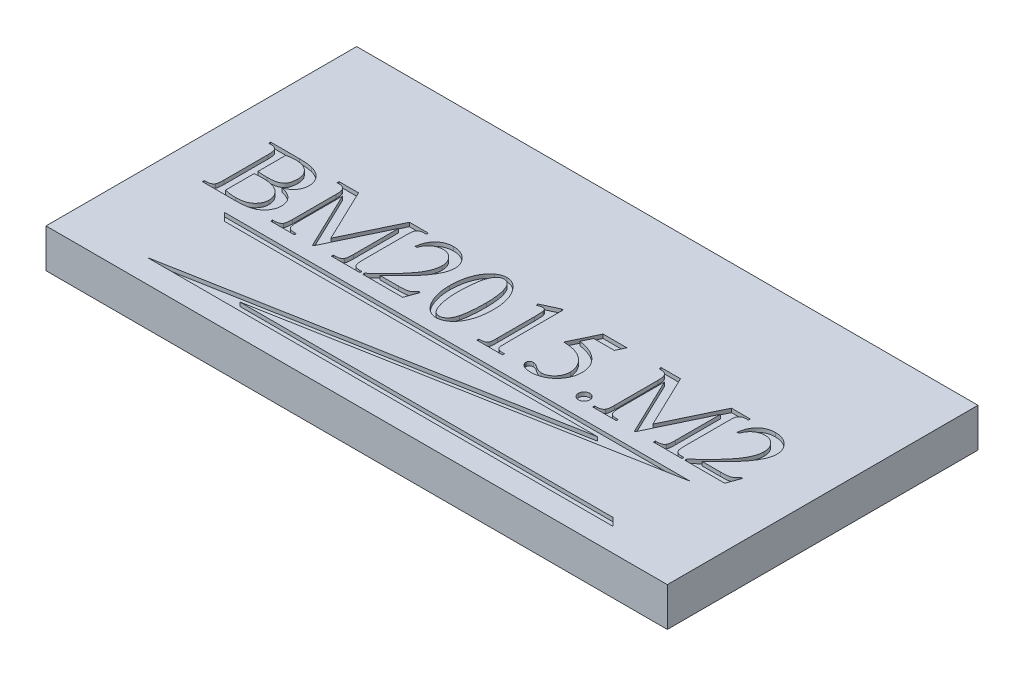
from build123d import *

# Parameters (mm, degrees)
SKETCH_1_W          = 160
SKETCH_1_H          = 80
EXTRUDE_1_DEPTH     = 10
CUT_EXTRUDE_1_DEPTH = 1
CUT_EXTRUDE_2_DEPTH = 1


with BuildPart() as part:
    # Эскиз1 → Бобышка-Вытянуть1 (new body)
    with BuildSketch(Plane(origin=(0, 0, 0), x_dir=(1, 0, 0), z_dir=(0, 1, 0))):
        Rectangle(SKETCH_1_W, SKETCH_1_H)
    extrude(amount=EXTRUDE_1_DEPTH)

    # Эскиз2 → Вырез-Вытянуть1 (cut)
    # profile 1 of 9: a face of its own
    with BuildSketch(Plane(origin=(0, 10, 0), x_dir=(1, 0, 0), z_dir=(0, 1, 0))):
        with BuildLine():
            add(Edge.make_bspline(
                [(-58.083307054, -1.12936359), (-57.935151583, -1.162218616), (-57.647224583, -1.226069441), (-57.233701046, -1.344617735), (-56.85051146, -1.47956541), (-56.493404032, -1.623649358), (-56.164474978, -1.783325876), (-55.864999545, -1.959081857), (-55.595654967, -2.150476291), (-55.433679051, -2.291199058), (-55.354468452, -2.360016293)],
                knots=[0, 0, 0, 0, 1.202298385, 2.336560135, 3.406084711, 4.420247637, 5.386399354, 6.300522109, 7.168909389, 8, 8, 8, 8], degree=3))
            add(Edge.make_bspline(
                [(-55.354468452, -2.360016293), (-55.254240258, -2.45868109), (-55.056391441, -2.653443788), (-54.800647537, -2.975704736), (-54.585222065, -3.31438968), (-54.407168596, -3.668692158), (-54.270098938, -4.040713305), (-54.169543605, -4.428340837), (-54.111729232, -4.832307411), (-54.104533282, -5.106509479), (-54.100884332, -5.245552911)],
                knots=[0, 0, 0, 0, 1.040892545, 2.054704896, 3.038886078, 4.009403739, 4.985637774, 5.96968326, 6.970459233, 8, 8, 8, 8], degree=3))
            add(Edge.make_bspline(
                [(-54.100884332, -5.245552911), (-54.109773906, -5.459326742), (-54.127634896, -5.888842475), (-54.295807273, -6.522135238), (-54.552689425, -7.143512483), (-54.912842113, -7.737821359), (-55.35300588, -8.29336594), (-55.890156435, -8.76594946), (-56.496512251, -9.163913784), (-57.062965395, -9.427120756), (-57.567328024, -9.591580546), (-57.996528063, -9.700807422), (-58.471665181, -9.79862292), (-58.995936524, -9.865487586), (-59.565085802, -9.929753148), (-60.182391491, -9.968570826), (-60.846269083, -9.997197456), (-61.305134604, -9.999045516), (-61.542129093, -10)],
                knots=[0, 0, 0, 0, 1.028770293, 2.067011775, 3.138033473, 4.261901228, 5.406207792, 6.541562624, 7.694800496, 8.892876887, 9.539626609, 10.250184141, 11.027081459, 11.876550478, 12.796927842, 13.788050093, 14.85757392, 16, 16, 16, 16], degree=3))
            Line((-61.542129093, -10), (-69.75539822, -10))
            Line((-69.75539822, -10), (-69.75539822, -9.510796441))
            Line((-69.75539822, -9.510796441), (-69.117140452, -9.510796441))
            add(Edge.make_bspline(
                [(-69.117140452, -9.510796441), (-69.031623978, -9.508896469), (-68.866223486, -9.505221663), (-68.628601462, -9.468555371), (-68.407591735, -9.418383705), (-68.208553017, -9.33583787), (-68.025639816, -9.235762485), (-67.860349201, -9.114310171), (-67.716452197, -8.965560139), (-67.636649307, -8.85326698), (-67.596023136, -8.796100616)],
                knots=[0, 0, 0, 0, 1.166786496, 2.256723755, 3.277842578, 4.25348796, 5.187934752, 6.120436128, 7.043148905, 8, 8, 8, 8], degree=3))
            add(Edge.make_bspline(
                [(-67.596023136, -8.796100616), (-67.571713165, -8.752126879), (-67.519273623, -8.65727022), (-67.465120099, -8.488517952), (-67.415028953, -8.29096451), (-67.378860094, -8.059207847), (-67.348406901, -7.795301677), (-67.326671955, -7.498195236), (-67.310194933, -7.169426686), (-67.309659765, -6.939953985), (-67.309380425, -6.820176866)],
                knots=[0, 0, 0, 0, 0.597321695, 1.288494999, 2.101981578, 3.025155317, 4.079375286, 5.266669335, 6.573292293, 8, 8, 8, 8], degree=3))
            Line((-67.309380425, -6.820176866), (-67.309380425, 4.431504991))
            add(Edge.make_bspline(
                [(-67.309380425, 4.431504991), (-67.309187714, 4.564044157), (-67.308820582, 4.816542143), (-67.331060069, 5.175734867), (-67.353432169, 5.49775157), (-67.397357301, 5.780488463), (-67.445093055, 6.026200292), (-67.503113973, 6.234101896), (-67.579857841, 6.40226176), (-67.643258386, 6.494765474), (-67.672461192, 6.537373437)],
                knots=[0, 0, 0, 0, 1.467983741, 2.79662948, 3.986363477, 5.042318655, 5.964098798, 6.759038926, 7.428403245, 8, 8, 8, 8], degree=3))
            add(Edge.make_bspline(
                [(-67.672461192, 6.537373437), (-67.75871544, 6.62793383), (-67.93276243, 6.810669917), (-68.27906898, 6.993817977), (-68.679994602, 7.101831697), (-68.966045307, 7.115110536), (-69.117140452, 7.122124566)],
                knots=[0, 0, 0, 0, 0.927123666, 1.870784184, 2.875324672, 4, 4, 4, 4], degree=3))
            Line((-69.117140452, 7.122124566), (-69.75539822, 7.122124566))
            Line((-69.75539822, 7.122124566), (-69.75539822, 7.611328125))
            Line((-69.75539822, 7.611328125), (-62.321797265, 7.611328125))
            add(Edge.make_bspline(
                [(-62.321797265, 7.611328125), (-61.991696852, 7.608620798), (-61.366532154, 7.603493494), (-60.480230914, 7.540198231), (-59.694905134, 7.449140638), (-59.211425828, 7.343516417), (-58.985276116, 7.294110192)],
                knots=[0, 0, 0, 0, 1.179035714, 2.232931189, 3.173445281, 4, 4, 4, 4], degree=3))
            add(Edge.make_bspline(
                [(-58.985276116, 7.294110192), (-58.830475378, 7.252962713), (-58.528036356, 7.172571601), (-58.094236564, 7.017852333), (-57.687918639, 6.842263366), (-57.308550965, 6.64475572), (-56.960169398, 6.420895489), (-56.635313397, 6.180274305), (-56.341120668, 5.912497706), (-56.077791535, 5.621954778), (-55.845558733, 5.314460125), (-55.635433656, 4.998206342), (-55.46620313, 4.664377227), (-55.321125295, 4.323333768), (-55.216617894, 3.968594551), (-55.133743431, 3.605365528), (-55.088177792, 3.228770232), (-55.082276671, 2.974197134), (-55.07929145, 2.845415327)],
                knots=[0, 0, 0, 0, 1.197163213, 2.33893505, 3.43955965, 4.504702612, 5.532566955, 6.532694419, 7.523891994, 8.501634608, 9.459882266, 10.403051993, 11.336018195, 12.25408421, 13.170072591, 14.09679423, 15.037218469, 16, 16, 16, 16], degree=3))
            add(Edge.make_bspline(
                [(-55.07929145, 2.845415327), (-55.087105251, 2.626697856), (-55.102503874, 2.195672354), (-55.254775946, 1.570239949), (-55.494999798, 0.980157447), (-55.769984581, 0.520936195), (-56.040008985, 0.18304697), (-56.260992368, -0.061223322), (-56.510751786, -0.280656081), (-56.780704725, -0.486435746), (-57.075219861, -0.671124202), (-57.389016851, -0.845114708), (-57.727138198, -0.997833345), (-57.962993001, -1.084932594), (-58.083307054, -1.12936359)],
                knots=[0, 0, 0, 0, 1.471082931, 2.899056279, 4.307818116, 5.751614296, 6.484736272, 7.219614112, 7.967209451, 8.720692231, 9.503935749, 10.306636219, 11.136182697, 12, 12, 12, 12], degree=3))
        make_face()
        with BuildLine():
            add(Edge.make_bspline(
                [(-64.86336263, -0.514037238), (-64.692945887, -0.544093737), (-64.330720479, -0.607979641), (-63.74976447, -0.665695354), (-63.104427144, -0.699142348), (-62.653075855, -0.703077259), (-62.417344835, -0.705132378)],
                knots=[0, 0, 0, 0, 0.844887106, 1.795830451, 2.848809897, 4, 4, 4, 4], degree=3))
            add(Edge.make_bspline(
                [(-62.417344835, -0.705132378), (-62.264458487, -0.703354118), (-61.968755926, -0.699914726), (-61.540241642, -0.682406439), (-61.141479761, -0.646432822), (-60.77225986, -0.603915856), (-60.432400817, -0.539958425), (-60.120906283, -0.471510955), (-59.83948761, -0.381490273), (-59.509469981, -0.253532815), (-59.145320321, -0.055754639), (-58.782767834, 0.249409046), (-58.5028781, 0.615111097), (-58.309990283, 1.035402248), (-58.185415618, 1.49099766), (-58.082207176, 1.965085911), (-58.025496826, 2.460574051), (-58.018212998, 2.796874932), (-58.014512804, 2.967716217)],
                knots=[0, 0, 0, 0, 1.091830023, 2.111744693, 3.061402081, 3.95056914, 4.764258185, 5.530001833, 6.226288629, 6.871621508, 8.056545267, 9.166642, 10.231067328, 11.317616446, 12.446050905, 13.598649409, 14.780110772, 16, 16, 16, 16], degree=3))
            add(Edge.make_bspline(
                [(-58.014512804, 2.967716217), (-58.018532349, 3.100348912), (-58.026450031, 3.361608221), (-58.078788197, 3.746816082), (-58.17745199, 4.11571906), (-58.305925913, 4.471005959), (-58.472293973, 4.812706909), (-58.678876152, 5.1359246), (-58.923389495, 5.44449433), (-59.199645402, 5.737669378), (-59.513245855, 6.006493611), (-59.863872586, 6.240298016), (-60.246837904, 6.439488964), (-60.665050033, 6.600434926), (-61.115481955, 6.726083784), (-61.601863798, 6.812476281), (-62.120568156, 6.866431758), (-62.478357766, 6.873761667), (-62.661946615, 6.877522786)],
                knots=[0, 0, 0, 0, 0.932104058, 1.836054539, 2.724128921, 3.610577454, 4.48739039, 5.388899496, 6.300486582, 7.250348221, 8.215526472, 9.196272454, 10.205292906, 11.242666987, 12.339557976, 13.48617357, 14.710106481, 16, 16, 16, 16], degree=3))
            add(Edge.make_bspline(
                [(-62.661946615, 6.877522786), (-62.860795409, 6.873608591), (-63.249040527, 6.865966266), (-63.816627037, 6.813568002), (-64.353439342, 6.719038008), (-64.695808207, 6.625292952), (-64.86336263, 6.579414368)],
                knots=[0, 0, 0, 0, 1.070391011, 2.089899941, 3.065202048, 4, 4, 4, 4], degree=3))
            Line((-64.86336263, 6.579414368), (-64.86336263, -0.514037238))
        make_face(mode=Mode.SUBTRACT)
        with BuildLine():
            add(Edge.make_bspline(
                [(-64.86336263, -8.910757701), (-64.61299155, -8.966180517), (-64.114860083, -9.076448239), (-63.363817105, -9.184042878), (-62.617351025, -9.252129061), (-62.121930429, -9.261511361), (-61.874634637, -9.266194661)],
                knots=[0, 0, 0, 0, 1.019899824, 2.029164851, 3.016231376, 4, 4, 4, 4], degree=3))
            add(Edge.make_bspline(
                [(-61.874634637, -9.266194661), (-61.683369781, -9.264270033), (-61.312764466, -9.260540768), (-60.774376461, -9.2029356), (-60.270130022, -9.1230579), (-59.801690352, -9.002553889), (-59.365782736, -8.856219159), (-58.968358656, -8.667884751), (-58.604287484, -8.448091229), (-58.275754279, -8.197059756), (-57.988329946, -7.917211908), (-57.731150394, -7.625922238), (-57.51743584, -7.314627966), (-57.338767101, -6.989153368), (-57.205635762, -6.643858337), (-57.105081161, -6.286025716), (-57.046688177, -5.909925052), (-57.039679488, -5.654695807), (-57.036105686, -5.524551815)],
                knots=[0, 0, 0, 0, 1.335369974, 2.58748639, 3.778398001, 4.898614871, 5.962444548, 6.985554789, 7.963871145, 8.928614683, 9.866425566, 10.762210136, 11.638554271, 12.498661649, 13.349744001, 14.217688406, 15.091181162, 16, 16, 16, 16], degree=3))
            add(Edge.make_bspline(
                [(-57.036105686, -5.524551815), (-57.044261503, -5.352107441), (-57.060606005, -5.006523727), (-57.16883186, -4.492320686), (-57.362031352, -3.993866839), (-57.61631526, -3.505399873), (-57.950977807, -3.043834451), (-58.380301928, -2.636913587), (-58.88735204, -2.276838993), (-59.479994141, -1.978732112), (-60.147210303, -1.733123454), (-60.891331413, -1.559195298), (-61.708700466, -1.456962118), (-62.278174481, -1.445100422), (-62.57404285, -1.438937717)],
                knots=[0, 0, 0, 0, 0.80426076, 1.611762754, 2.437163379, 3.29025987, 4.174362993, 5.081949637, 6.03643416, 7.064744133, 8.166225842, 9.344998398, 10.620602567, 12, 12, 12, 12], degree=3))
            add(Edge.make_bspline(
                [(-62.57404285, -1.438937717), (-62.702722848, -1.438160339), (-62.951191532, -1.436659297), (-63.309109527, -1.447026636), (-63.637907963, -1.452656868), (-64.017637519, -1.468393209), (-64.424649074, -1.488178676), (-64.72856052, -1.536142157), (-64.86336263, -1.557416704)],
                knots=[0, 0, 0, 0, 1.009225997, 1.948718216, 2.808291512, 3.588270035, 4.930259813, 6, 6, 6, 6], degree=3))
            Line((-64.86336263, -1.557416704), (-64.86336263, -8.910757701))
        make_face(mode=Mode.SUBTRACT)
    # profile 2 of 9: a face of its own
    with BuildSketch(Plane(origin=(0, 10, 0), x_dir=(1, 0, 0), z_dir=(0, 1, 0))):
        with BuildLine():
            Line((-41.381591797, -10), (-48.475043403, 4.817517175))
            Line((-48.475043403, 4.817517175), (-48.475043403, -6.820176866))
            add(Edge.make_bspline(
                [(-48.475043403, -6.820176866), (-48.475224162, -6.955261145), (-48.475567139, -7.211573693), (-48.453681123, -7.57589808), (-48.429942711, -7.901426525), (-48.390519157, -8.186701203), (-48.348683291, -8.434798906), (-48.286350012, -8.639672396), (-48.221565226, -8.809918629), (-48.159424357, -8.900159771), (-48.13107215, -8.941332923)],
                knots=[0, 0, 0, 0, 1.48973486, 2.826663046, 4.025252461, 5.088590954, 6.003687083, 6.795186099, 7.45029523, 8, 8, 8, 8], degree=3))
            add(Edge.make_bspline(
                [(-48.13107215, -8.941332923), (-48.044633234, -9.029283516), (-47.868608314, -9.208386828), (-47.515174715, -9.388466568), (-47.099129811, -9.495079221), (-46.799236034, -9.505357239), (-46.640530056, -9.510796441)],
                knots=[0, 0, 0, 0, 0.893460505, 1.819450328, 2.846037184, 4, 4, 4, 4], degree=3))
            Line((-46.640530056, -9.510796441), (-46.029025608, -9.510796441))
            Line((-46.029025608, -9.510796441), (-46.029025608, -10))
            Line((-46.029025608, -10), (-52.144070095, -10))
            Line((-52.144070095, -10), (-52.144070095, -9.510796441))
            Line((-52.144070095, -9.510796441), (-51.532565647, -9.510796441))
            add(Edge.make_bspline(
                [(-51.532565647, -9.510796441), (-51.444512528, -9.508874283), (-51.274061196, -9.505153411), (-51.028740976, -9.468702177), (-50.802097877, -9.418104563), (-50.595868322, -9.33937337), (-50.40809511, -9.241570039), (-50.241366342, -9.118046394), (-50.09860767, -8.969822735), (-50.017862565, -8.859503545), (-49.977051205, -8.803744422)],
                knots=[0, 0, 0, 0, 1.182386838, 2.288838982, 3.326958154, 4.296765023, 5.246416275, 6.164047556, 7.072046332, 8, 8, 8, 8], degree=3))
            add(Edge.make_bspline(
                [(-49.977051205, -8.803744422), (-49.954270382, -8.762227325), (-49.904120352, -8.670830994), (-49.848621244, -8.508339338), (-49.805341866, -8.310440578), (-49.762452009, -8.080093594), (-49.732410828, -7.813218108), (-49.716775585, -7.513311385), (-49.698335248, -7.178367859), (-49.698149942, -6.943784475), (-49.6980523, -6.820176866)],
                knots=[0, 0, 0, 0, 0.561580455, 1.236271222, 2.028879402, 2.966584022, 4.017422664, 5.2149421, 6.532486222, 8, 8, 8, 8], degree=3))
            Line((-49.6980523, -6.820176866), (-49.6980523, 4.431504991))
            add(Edge.make_bspline(
                [(-49.6980523, 4.431504991), (-49.699976551, 4.621522776), (-49.703548912, 4.9742897), (-49.753858364, 5.459502225), (-49.825140608, 5.863803464), (-49.914062291, 6.093672525), (-49.954119788, 6.197224087)],
                knots=[0, 0, 0, 0, 1.269100049, 2.356076937, 3.259444487, 4, 4, 4, 4], degree=3))
            add(Edge.make_bspline(
                [(-49.954119788, 6.197224087), (-49.987685313, 6.26097027), (-50.056737383, 6.392110954), (-50.203440631, 6.567260268), (-50.390281442, 6.72258539), (-50.614620977, 6.867275248), (-50.898281446, 6.988835152), (-51.251189315, 7.067655514), (-51.673881339, 7.116087696), (-51.979566908, 7.120012469), (-52.144070095, 7.122124566)],
                knots=[0, 0, 0, 0, 0.685675889, 1.410594349, 2.160436148, 2.996293973, 3.94870651, 5.086176952, 6.431940446, 8, 8, 8, 8], degree=3))
            Line((-52.144070095, 7.122124566), (-52.144070095, 7.611328125))
            Line((-52.144070095, 7.611328125), (-47.129733615, 7.611328125))
            Line((-47.129733615, 7.611328125), (-40.578992208, -6.071083917))
            Line((-40.578992208, -6.071083917), (-34.0282508, 7.611328125))
            Line((-34.0282508, 7.611328125), (-29.151502821, 7.611328125))
            Line((-29.151502821, 7.611328125), (-29.151502821, 7.122124566))
            Line((-29.151502821, 7.122124566), (-29.751541562, 7.122124566))
            add(Edge.make_bspline(
                [(-29.751541562, 7.122124566), (-29.840881134, 7.120293258), (-30.012630645, 7.116772686), (-30.260326634, 7.079476113), (-30.488561493, 7.030130603), (-30.69581301, 6.950585862), (-30.88386158, 6.853113694), (-31.050378351, 6.728114751), (-31.197076831, 6.582509492), (-31.277924441, 6.471044301), (-31.318521712, 6.415072547)],
                knots=[0, 0, 0, 0, 1.192663738, 2.292818382, 3.341598875, 4.305885976, 5.250132179, 6.162540657, 7.077327887, 8, 8, 8, 8], degree=3))
            add(Edge.make_bspline(
                [(-31.318521712, 6.415072547), (-31.341302535, 6.37355545), (-31.391452565, 6.282159119), (-31.446951673, 6.119667463), (-31.49023105, 5.921768703), (-31.533120908, 5.691421719), (-31.563162089, 5.424546233), (-31.578797332, 5.12463951), (-31.597237669, 4.789695984), (-31.597422974, 4.5551126), (-31.597520616, 4.431504991)],
                knots=[0, 0, 0, 0, 0.561580455, 1.236271222, 2.028879402, 2.966584022, 4.017422664, 5.2149421, 6.532486222, 8, 8, 8, 8], degree=3))
            Line((-31.597520616, 4.431504991), (-31.597520616, -6.820176866))
            add(Edge.make_bspline(
                [(-31.597520616, -6.820176866), (-31.597683342, -6.955257386), (-31.597992101, -7.211562802), (-31.576334729, -7.575934845), (-31.551860101, -7.901309842), (-31.514693869, -8.187303867), (-31.465886306, -8.4341995), (-31.406224026, -8.640621855), (-31.336310192, -8.810298427), (-31.27166525, -8.900195792), (-31.242083655, -8.941332923)],
                knots=[0, 0, 0, 0, 1.486776415, 2.821049613, 4.017258766, 5.078485589, 5.994452933, 6.784380121, 7.443731031, 8, 8, 8, 8], degree=3))
            add(Edge.make_bspline(
                [(-31.242083655, -8.941332923), (-31.155718913, -9.029440256), (-30.979052652, -9.209671132), (-30.624150738, -9.386686811), (-30.209129193, -9.495788696), (-29.910324729, -9.505588745), (-29.751541562, -9.510796441)],
                knots=[0, 0, 0, 0, 0.893634595, 1.828003868, 2.845812335, 4, 4, 4, 4], degree=3))
            Line((-29.751541562, -9.510796441), (-29.151502821, -9.510796441))
            Line((-29.151502821, -9.510796441), (-29.151502821, -10))
            Line((-29.151502821, -10), (-36.489556207, -10))
            Line((-36.489556207, -10), (-36.489556207, -9.510796441))
            Line((-36.489556207, -9.510796441), (-35.878051758, -9.510796441))
            add(Edge.make_bspline(
                [(-35.878051758, -9.510796441), (-35.788729236, -9.508908991), (-35.617012503, -9.505280493), (-35.370318142, -9.468915019), (-35.142892304, -9.417114805), (-34.935344757, -9.341362154), (-34.749116434, -9.240317632), (-34.583127351, -9.11807279), (-34.440165821, -8.970838698), (-34.361884496, -8.859638089), (-34.322537316, -8.803744422)],
                knots=[0, 0, 0, 0, 1.198333024, 2.303717216, 3.340834392, 4.325725627, 5.259386468, 6.176132048, 7.08325442, 8, 8, 8, 8], degree=3))
            add(Edge.make_bspline(
                [(-34.322537316, -8.803744422), (-34.299756493, -8.762227325), (-34.249606463, -8.670830994), (-34.194107355, -8.508339338), (-34.150827978, -8.310440578), (-34.10793812, -8.080093594), (-34.077896939, -7.813218108), (-34.062261696, -7.513311385), (-34.043821359, -7.178367859), (-34.043636054, -6.943784475), (-34.043538411, -6.820176866)],
                knots=[0, 0, 0, 0, 0.561580455, 1.236271222, 2.028879402, 2.966584022, 4.017422664, 5.2149421, 6.532486222, 8, 8, 8, 8], degree=3))
            Line((-34.043538411, -6.820176866), (-34.043538411, 4.817517175))
            Line((-34.043538411, 4.817517175), (-41.136990017, -10))
            Line((-41.136990017, -10), (-41.381591797, -10))
        make_face()
    # profile 3 of 9: a face of its own
    with BuildSketch(Plane(origin=(0, 10, 0), x_dir=(1, 0, 0), z_dir=(0, 1, 0))):
        with BuildLine():
            Line((-16.921413845, -6.625259823), (-18.14060084, -10))
            Line((-18.14060084, -10), (-28.417697483, -10))
            Line((-28.417697483, -10), (-28.417697483, -9.522262149))
            add(Edge.make_bspline(
                [(-28.417697483, -9.522262149), (-28.049962701, -9.184284741), (-27.337208561, -8.529207198), (-26.317028371, -7.564400857), (-25.382387985, -6.646322311), (-24.533063777, -5.775332429), (-23.768274698, -4.952023491), (-23.089825636, -4.173799915), (-22.492136687, -3.447487308), (-21.977980964, -2.7593731), (-21.531297964, -2.10503188), (-21.152910225, -1.4657044), (-20.830235974, -0.8421502), (-20.56276819, -0.233347909), (-20.359861129, 0.364295092), (-20.213485834, 0.946947654), (-20.120603261, 1.514976731), (-20.107610584, 1.889612186), (-20.101236979, 2.073390961)],
                knots=[0, 0, 0, 0, 1.640196139, 3.179075376, 4.61094688, 5.942305235, 7.173872596, 8.30065911, 9.332401675, 10.262017718, 11.120692698, 11.932909408, 12.700076558, 13.425218913, 14.114511764, 14.770003029, 15.396620544, 16, 16, 16, 16], degree=3))
            add(Edge.make_bspline(
                [(-20.101236979, 2.073390961), (-20.10370474, 2.209869651), (-20.108542321, 2.477410385), (-20.160291182, 2.868665388), (-20.240869872, 3.241830458), (-20.349058871, 3.598074853), (-20.498284173, 3.932849655), (-20.671406647, 4.252011432), (-20.886201144, 4.547209051), (-21.124060691, 4.824611076), (-21.385867657, 5.074798563), (-21.66300152, 5.293732585), (-21.950447126, 5.483527854), (-22.252568271, 5.63743977), (-22.569317732, 5.751446209), (-22.8967657, 5.835682054), (-23.237044746, 5.892573979), (-23.469376136, 5.896919264), (-23.586812337, 5.899115668)],
                knots=[0, 0, 0, 0, 1.134419306, 2.223815103, 3.275304008, 4.307399035, 5.313221346, 6.318597171, 7.32112197, 8.342723066, 9.354331769, 10.327252885, 11.276405737, 12.214555788, 13.139633085, 14.069852934, 15.024371439, 16, 16, 16, 16], degree=3))
            add(Edge.make_bspline(
                [(-23.586812337, 5.899115668), (-23.799140972, 5.891013996), (-24.21725078, 5.875060479), (-24.824863941, 5.726892013), (-25.399228557, 5.491312143), (-25.934481849, 5.162069128), (-26.419679188, 4.742389989), (-26.841795751, 4.233577877), (-27.192538134, 3.635052479), (-27.360368563, 3.192275286), (-27.44693417, 2.963894314)],
                knots=[0, 0, 0, 0, 0.978774112, 1.927366301, 2.868767021, 3.835023234, 4.81480387, 5.817007219, 6.874029602, 8, 8, 8, 8], degree=3))
            Line((-27.44693417, 2.963894314), (-27.928493924, 2.963894314))
            add(Edge.make_bspline(
                [(-27.928493924, 2.963894314), (-27.899622971, 3.155558226), (-27.843215303, 3.53002853), (-27.710501317, 4.069536579), (-27.55258225, 4.576946559), (-27.355519174, 5.046960457), (-27.134390838, 5.487427775), (-26.878727441, 5.892127147), (-26.590404285, 6.263183943), (-26.267732069, 6.594806512), (-25.922030566, 6.893128235), (-25.552086656, 7.149704246), (-25.163924952, 7.372048836), (-24.75043071, 7.544532532), (-24.318708276, 7.684835618), (-23.866697178, 7.782294838), (-23.393748217, 7.846687545), (-23.07107543, 7.85280833), (-22.906513638, 7.855929905)],
                knots=[0, 0, 0, 0, 1.200501633, 2.345523519, 3.439068721, 4.490246694, 5.499995932, 6.48995494, 7.451685612, 8.406391985, 9.352574024, 10.27676432, 11.192316343, 12.119031984, 13.047762957, 14.001652993, 14.980851257, 16, 16, 16, 16], degree=3))
            add(Edge.make_bspline(
                [(-22.906513638, 7.855929905), (-22.73182676, 7.850989345), (-22.389023402, 7.841294053), (-21.884418405, 7.780738851), (-21.402400767, 7.672808773), (-20.940193943, 7.525111162), (-20.504405459, 7.327144342), (-20.087066374, 7.094731764), (-19.696360766, 6.811978979), (-19.330096058, 6.49413165), (-18.993587465, 6.149570204), (-18.704831758, 5.78041709), (-18.45035961, 5.402142391), (-18.254061616, 5.00159255), (-18.094499051, 4.58903364), (-17.97912917, 4.161582388), (-17.913606904, 3.716294331), (-17.904466544, 3.415089713), (-17.899820964, 3.262002733)],
                knots=[0, 0, 0, 0, 1.109419983, 2.177111989, 3.221343547, 4.242152537, 5.252521162, 6.255999647, 7.270763728, 8.308866099, 9.333003754, 10.32358272, 11.281716678, 12.222409134, 13.149434629, 14.0874794, 15.027963099, 16, 16, 16, 16], degree=3))
            add(Edge.make_bspline(
                [(-17.899820964, 3.262002733), (-17.906885075, 3.039774486), (-17.921112713, 2.592190497), (-18.047207343, 1.924911451), (-18.240045278, 1.255752628), (-18.42972743, 0.825529217), (-18.526613024, 0.605780284)],
                knots=[0, 0, 0, 0, 0.968670703, 1.950973842, 2.953401185, 4, 4, 4, 4], degree=3))
            add(Edge.make_bspline(
                [(-18.526613024, 0.605780284), (-18.610913654, 0.428757641), (-18.78282303, 0.067765657), (-19.09080369, -0.462221098), (-19.425703527, -1.004892836), (-19.797131775, -1.55723393), (-20.209623466, -2.114039465), (-20.664047598, -2.675068601), (-21.147386427, -3.250337108), (-21.49228952, -3.627566572), (-21.668217129, -3.819983164)],
                knots=[0, 0, 0, 0, 0.863272392, 1.760421205, 2.69783519, 3.672094839, 4.691137575, 5.748887515, 6.851756197, 8, 8, 8, 8], degree=3))
            add(Edge.make_bspline(
                [(-21.668217129, -3.819983164), (-21.927939485, -4.087678129), (-22.42227903, -4.597192247), (-23.128719542, -5.320150772), (-23.76605255, -5.961921808), (-24.325096361, -6.532859337), (-24.817766094, -7.021209511), (-25.239043973, -7.430554108), (-25.585947855, -7.764045295), (-25.79563336, -7.958083803), (-25.887597826, -8.043185764)],
                knots=[0, 0, 0, 0, 1.49931882, 2.853711152, 4.0632012, 5.135089847, 6.065735724, 6.851603135, 7.496332836, 8, 8, 8, 8], degree=3))
            Line((-25.887597826, -8.043185764), (-21.236342112, -8.043185764))
            add(Edge.make_bspline(
                [(-21.236342112, -8.043185764), (-21.017197625, -8.041745886), (-20.614485178, -8.039099883), (-20.062671956, -8.020081787), (-19.617193774, -7.993814419), (-19.26163778, -7.948212422), (-18.965908948, -7.880166739), (-18.699841131, -7.788563046), (-18.446139388, -7.673131375), (-18.20829291, -7.525869003), (-17.981817191, -7.351223065), (-17.774103175, -7.139737641), (-17.576851451, -6.900284294), (-17.466993092, -6.718530088), (-17.410617405, -6.625259823)],
                knots=[0, 0, 0, 0, 1.821637222, 3.347544769, 4.589491042, 5.530053278, 6.323823777, 7.107498442, 7.865641253, 8.635746017, 9.428031577, 10.236778878, 11.095173072, 12, 12, 12, 12], degree=3))
            Line((-17.410617405, -6.625259823), (-16.921413845, -6.625259823))
        make_face()
    # profile 4 of 9: a face of its own
    with BuildSketch(Plane(origin=(0, 10, 0), x_dir=(1, 0, 0), z_dir=(0, 1, 0))):
        with BuildLine():
            add(Edge.make_bspline(
                [(-14.71999783, -1.324280633), (-14.716463312, -1.079638546), (-14.709518908, -0.598980708), (-14.67262676, 0.108899861), (-14.60431309, 0.791361978), (-14.503987398, 1.446363769), (-14.382160885, 2.07666124), (-14.234859207, 2.681014159), (-14.054194106, 3.258475859), (-13.849054524, 3.808627234), (-13.617551902, 4.327053844), (-13.377520059, 4.818453922), (-13.105963534, 5.269500413), (-12.825737006, 5.69007838), (-12.526766354, 6.07700528), (-12.20291243, 6.422727906), (-11.869948706, 6.744886236), (-11.626237937, 6.928284061), (-11.505777571, 7.01893319)],
                knots=[0, 0, 0, 0, 1.267948223, 2.491187271, 3.672419621, 4.820944812, 5.924168987, 6.998668076, 8.042818115, 9.058224754, 10.039662809, 10.984530588, 11.890392543, 12.765710998, 13.603053422, 14.420720048, 15.219399938, 16, 16, 16, 16], degree=3))
            add(Edge.make_bspline(
                [(-11.505777571, 7.01893319), (-11.31960454, 7.147533712), (-10.959488199, 7.396286979), (-10.372000283, 7.657086086), (-9.77728641, 7.823851146), (-9.374209431, 7.845298919), (-9.17441686, 7.855929905)],
                knots=[0, 0, 0, 0, 1.076116545, 2.081542914, 3.049081206, 4, 4, 4, 4], degree=3))
            add(Edge.make_bspline(
                [(-9.17441686, 7.855929905), (-9.012134387, 7.850469588), (-8.689784333, 7.839623479), (-8.213989406, 7.739147568), (-7.751420934, 7.577555408), (-7.303044685, 7.349378672), (-6.867223318, 7.059280607), (-6.446228827, 6.703849965), (-6.036030137, 6.287138449), (-5.786625137, 5.972925065), (-5.658266279, 5.811211904)],
                knots=[0, 0, 0, 0, 0.921550053, 1.830522441, 2.751246923, 3.70019056, 4.682375705, 5.720881843, 6.827028318, 8, 8, 8, 8], degree=3))
            add(Edge.make_bspline(
                [(-5.658266279, 5.811211904), (-5.502362148, 5.593641132), (-5.18758535, 5.154356873), (-4.788844756, 4.433668801), (-4.459729993, 3.654101274), (-4.18117436, 2.821983027), (-3.975341736, 1.931822646), (-3.821749089, 0.98724994), (-3.729591723, -0.014085673), (-3.718564491, -0.701116264), (-3.712917752, -1.052925534)],
                knots=[0, 0, 0, 0, 0.883963831, 1.784759013, 2.714530965, 3.677036329, 4.680787027, 5.730006124, 6.837599228, 8, 8, 8, 8], degree=3))
            add(Edge.make_bspline(
                [(-3.712917752, -1.052925534), (-3.71423776, -1.301432704), (-3.716825662, -1.78863558), (-3.763128327, -2.504805296), (-3.823376957, -3.192815174), (-3.922513952, -3.851280557), (-4.037093284, -4.483908971), (-4.188695315, -5.08613273), (-4.357208489, -5.662270482), (-4.562268169, -6.203847093), (-4.78299341, -6.713317505), (-5.014882356, -7.19141007), (-5.268762012, -7.629584918), (-5.530460645, -8.036685463), (-5.809873939, -8.405102838), (-6.105757391, -8.735480764), (-6.415644104, -9.031654013), (-6.74006793, -9.289439494), (-7.067559408, -9.514747915), (-7.39561443, -9.706688045), (-7.718954396, -9.872260638), (-8.041753384, -10.005121572), (-8.358226209, -10.115879236), (-8.67407939, -10.185959839), (-8.985553079, -10.23605179), (-9.193329928, -10.241760953), (-9.29671775, -10.24460178)],
                knots=[0, 0, 0, 0, 1.510050896, 2.960482548, 4.360412811, 5.706191847, 7.006128856, 8.266230485, 9.478809624, 10.652394328, 11.782968825, 12.852979618, 13.879641343, 14.858961868, 15.792780312, 16.68657793, 17.551917979, 18.394760493, 19.202293251, 19.965865945, 20.70343888, 21.408045917, 22.086293389, 22.738035093, 23.372058038, 24, 24, 24, 24], degree=3))
            add(Edge.make_bspline(
                [(-9.29671775, -10.24460178), (-9.496306248, -10.236105273), (-9.891434928, -10.219284598), (-10.469397398, -10.0742171), (-11.022865454, -9.844109964), (-11.545281894, -9.512280361), (-12.042523337, -9.093471148), (-12.514241373, -8.583796591), (-12.95767734, -7.980958563), (-13.217150431, -7.533739377), (-13.351756626, -7.30173662)],
                knots=[0, 0, 0, 0, 0.907345466, 1.796286953, 2.695609492, 3.62566933, 4.601329434, 5.647644493, 6.779674527, 8, 8, 8, 8], degree=3))
            add(Edge.make_bspline(
                [(-13.351756626, -7.30173662), (-13.462040604, -7.091828026), (-13.684726231, -6.667980178), (-13.961211559, -5.997423386), (-14.195380691, -5.294808941), (-14.38350185, -4.560985583), (-14.539434757, -3.797580759), (-14.644672986, -3.002015534), (-14.705447758, -2.17370069), (-14.715086062, -1.611025217), (-14.71999783, -1.324280633)],
                knots=[0, 0, 0, 0, 0.917887123, 1.853399498, 2.805111979, 3.783983157, 4.785434396, 5.820907986, 6.889514713, 8, 8, 8, 8], degree=3))
        make_face()
        with BuildLine():
            add(Edge.make_bspline(
                [(-12.273980035, -1.630032857), (-12.270427448, -1.926895958), (-12.263487061, -2.506852262), (-12.227482365, -3.354829188), (-12.15762883, -4.16042021), (-12.063467509, -4.924335618), (-11.941459916, -5.647492662), (-11.794087266, -6.329409246), (-11.615164062, -6.968446087), (-11.472215616, -7.375041348), (-11.402586195, -7.573091719)],
                knots=[0, 0, 0, 0, 1.180112402, 2.305485676, 3.372849049, 4.393553838, 5.364293091, 6.287088038, 7.165649773, 8, 8, 8, 8], degree=3))
            add(Edge.make_bspline(
                [(-11.402586195, -7.573091719), (-11.342129321, -7.726170833), (-11.226760413, -8.018289315), (-11.010936193, -8.413324186), (-10.779136525, -8.751823689), (-10.51972709, -9.027048437), (-10.240078764, -9.24749024), (-9.931571336, -9.396351967), (-9.604627151, -9.494608491), (-9.377696974, -9.505340201), (-9.262320624, -9.510796441)],
                knots=[0, 0, 0, 0, 1.27796888, 2.438728037, 3.490730404, 4.457262314, 5.368188585, 6.240469892, 7.105415757, 8, 8, 8, 8], degree=3))
            add(Edge.make_bspline(
                [(-9.262320624, -9.510796441), (-9.146753759, -9.503169853), (-8.907288098, -9.487366829), (-8.550213518, -9.359330316), (-8.193443473, -9.15359115), (-7.895187724, -8.932403571), (-7.66776357, -8.707388931), (-7.496172048, -8.513156939), (-7.345818302, -8.283790008), (-7.200685156, -8.032875856), (-7.06541163, -7.754883264), (-6.945653563, -7.45000118), (-6.832627558, -7.118892102), (-6.771518279, -6.886859128), (-6.739864773, -6.766670227)],
                knots=[0, 0, 0, 0, 1.037825602, 2.150474477, 3.371635047, 4.73778764, 5.475301301, 6.247273825, 7.064217381, 7.93705097, 8.854564737, 9.842063216, 10.882227619, 12, 12, 12, 12], degree=3))
            add(Edge.make_bspline(
                [(-6.739864773, -6.766670227), (-6.691984509, -6.570915662), (-6.592086057, -6.162488968), (-6.477333168, -5.516384293), (-6.377190064, -4.814083047), (-6.299684601, -4.053984101), (-6.233777563, -3.236011408), (-6.189418723, -2.361700762), (-6.162067534, -1.430199615), (-6.160001362, -0.790508791), (-6.158935547, -0.460530599)],
                knots=[0, 0, 0, 0, 0.761713504, 1.589256053, 2.479498212, 3.443272477, 4.477217009, 5.58167292, 6.752529866, 8, 8, 8, 8], degree=3))
            add(Edge.make_bspline(
                [(-6.158935547, -0.460530599), (-6.159629382, -0.214612933), (-6.160992469, 0.268509484), (-6.194505273, 0.97695574), (-6.238412856, 1.653864493), (-6.302212834, 2.299253145), (-6.391351118, 2.911944444), (-6.493431397, 3.494930178), (-6.613993289, 4.046400029), (-6.713954078, 4.400095359), (-6.76279619, 4.572915395)],
                knots=[0, 0, 0, 0, 1.160165125, 2.279225349, 3.345596166, 4.360583534, 5.338162882, 6.266121345, 7.152804842, 8, 8, 8, 8], degree=3))
            add(Edge.make_bspline(
                [(-6.76279619, 4.572915395), (-6.801194822, 4.693040211), (-6.875691025, 4.926091294), (-7.00203939, 5.259009709), (-7.135757725, 5.565192264), (-7.275657476, 5.846504952), (-7.430158808, 6.096977413), (-7.584314416, 6.325880344), (-7.754781803, 6.522216837), (-7.876601141, 6.637665072), (-7.936120351, 6.694071452)],
                knots=[0, 0, 0, 0, 1.233545328, 2.393169741, 3.481419258, 4.501374537, 5.463177041, 6.358578008, 7.198024365, 8, 8, 8, 8], degree=3))
            add(Edge.make_bspline(
                [(-7.936120351, 6.694071452), (-8.024343064, 6.760152644), (-8.199996597, 6.891721879), (-8.506354838, 7.025200606), (-8.837527169, 7.107654336), (-9.068174051, 7.117235107), (-9.185882568, 7.122124566)],
                knots=[0, 0, 0, 0, 0.978770933, 1.948756365, 2.953166656, 4, 4, 4, 4], degree=3))
            add(Edge.make_bspline(
                [(-9.185882568, 7.122124566), (-9.326141088, 7.112696826), (-9.607122944, 7.093810103), (-10.010568301, 6.93379536), (-10.387312521, 6.677668922), (-10.599300107, 6.447994887), (-10.710821788, 6.327168783)],
                knots=[0, 0, 0, 0, 0.945219573, 1.893571615, 2.891857598, 4, 4, 4, 4], degree=3))
            add(Edge.make_bspline(
                [(-10.710821788, 6.327168783), (-10.785441112, 6.231751638), (-10.938327755, 6.036252589), (-11.136380874, 5.705511462), (-11.320608916, 5.339968741), (-11.478702142, 4.931451834), (-11.623386436, 4.487327388), (-11.755362842, 4.004767909), (-11.858409166, 3.481613577), (-11.979365136, 2.738224876), (-12.098140853, 1.786537842), (-12.193307188, 0.641310564), (-12.26529688, -0.496570254), (-12.271090348, -1.25282525), (-12.273980035, -1.630032857)],
                knots=[0, 0, 0, 0, 0.529149883, 1.084168889, 1.682003891, 2.317081463, 2.996986461, 3.723908646, 4.502772949, 5.326906926, 7.016784336, 8.694047759, 10.351045161, 12, 12, 12, 12], degree=3))
        make_face(mode=Mode.SUBTRACT)
    # profile 5 of 9: a face of its own
    with BuildSketch(Plane(origin=(0, 10, 0), x_dir=(1, 0, 0), z_dir=(0, 1, 0))):
        with BuildLine():
            Line((0.68991428, 5.899115668), (4.897829268, 7.855929905))
            Line((4.897829268, 7.855929905), (5.33734809, 7.855929905))
            Line((5.33734809, 7.855929905), (5.33734809, -6.820176866))
            add(Edge.make_bspline(
                [(5.33734809, -6.820176866), (5.338865316, -6.94119563), (5.341740078, -7.170495834), (5.342102563, -7.496806078), (5.356987855, -7.785798922), (5.364248378, -8.039794341), (5.386740702, -8.257206428), (5.401639981, -8.441650521), (5.429787182, -8.589065411), (5.462450074, -8.738106942), (5.529761526, -8.890489327), (5.643939018, -9.047332516), (5.791464278, -9.180936335), (5.979239189, -9.301947197), (6.239477109, -9.386931689), (6.584318375, -9.452873892), (7.028274202, -9.495313531), (7.357773249, -9.505307076), (7.538764106, -9.510796441)],
                knots=[0, 0, 0, 0, 1.356933168, 2.571048021, 3.657379777, 4.601012336, 5.418253307, 6.107533085, 6.673460353, 7.099554724, 7.815972102, 8.521630774, 9.259509655, 10.036179522, 11.007509208, 12.304408113, 13.970044684, 16, 16, 16, 16], degree=3))
            Line((7.538764106, -9.510796441), (7.538764106, -10))
            Line((7.538764106, -10), (0.934516059, -10))
            Line((0.934516059, -10), (0.934516059, -9.510796441))
            add(Edge.make_bspline(
                [(0.934516059, -9.510796441), (1.119358656, -9.505547272), (1.454004337, -9.496043987), (1.901259925, -9.451719967), (2.241652704, -9.392437482), (2.491921338, -9.309344095), (2.664750121, -9.191038199), (2.80594145, -9.070495828), (2.913414102, -8.927970171), (2.990251767, -8.795243027), (3.035104864, -8.659344623), (3.057753732, -8.514845002), (3.087031097, -8.331957612), (3.102810184, -8.107006082), (3.118418554, -7.842062283), (3.13053365, -7.537520867), (3.131738522, -7.19216767), (3.134481571, -6.948844414), (3.135932075, -6.820176866)],
                knots=[0, 0, 0, 0, 2.071302469, 3.74996044, 5.029173581, 5.941282905, 6.673651071, 7.361112001, 8.012044112, 8.663601818, 9.069808009, 9.607263055, 10.29959599, 11.144699654, 12.131164582, 13.273777592, 14.558393644, 16, 16, 16, 16], degree=3))
            Line((3.135932075, -6.820176866), (3.135932075, 2.719292535))
            add(Edge.make_bspline(
                [(3.135932075, 2.719292535), (3.13678555, 2.861987852), (3.138416447, 3.134662813), (3.127379242, 3.524408011), (3.123968946, 3.87500229), (3.105095677, 4.18431461), (3.094098672, 4.453703488), (3.0679679, 4.681236189), (3.049663669, 4.87106125), (3.024752406, 4.982011728), (3.013631185, 5.031543732)],
                knots=[0, 0, 0, 0, 1.476765178, 2.821934835, 4.035278551, 5.104597693, 6.029081604, 6.824151588, 7.47506195, 8, 8, 8, 8], degree=3))
            add(Edge.make_bspline(
                [(3.013631185, 5.031543732), (2.997414931, 5.093214322), (2.966676299, 5.210113672), (2.897186859, 5.370584922), (2.808567208, 5.507095778), (2.6680286, 5.65268389), (2.446409033, 5.784375661), (2.247422734, 5.80215508), (2.146059248, 5.811211904)],
                knots=[0, 0, 0, 0, 0.903062441, 1.711795068, 2.468214314, 3.196286531, 4.571790261, 6, 6, 6, 6], degree=3))
            add(Edge.make_bspline(
                [(2.146059248, 5.811211904), (2.062932455, 5.804423211), (1.877726938, 5.789298084), (1.579671072, 5.711948477), (1.23847836, 5.582491261), (1.001238306, 5.470354154), (0.873365614, 5.409912109)],
                knots=[0, 0, 0, 0, 0.743837888, 1.657262055, 2.737261251, 4, 4, 4, 4], degree=3))
            Line((0.873365614, 5.409912109), (0.68991428, 5.899115668))
        make_face()
    # profile 6 of 9: a face of its own
    with BuildSketch(Plane(origin=(0, 10, 0), x_dir=(1, 0, 0), z_dir=(0, 1, 0))):
        with BuildLine():
            Line((21.970269097, 7.611328125), (20.953642951, 5.409912109))
            Line((20.953642951, 5.409912109), (15.637376149, 5.409912109))
            Line((15.637376149, 5.409912109), (14.460230086, 3.009757148))
            add(Edge.make_bspline(
                [(14.460230086, 3.009757148), (14.761661027, 2.964291131), (15.350419236, 2.87548641), (16.198051455, 2.675103694), (16.990825509, 2.431280715), (17.726169497, 2.139103929), (18.402964327, 1.792444081), (19.023926022, 1.40229514), (19.593500616, 0.967975102), (19.925282361, 0.633926847), (20.089892917, 0.468191783)],
                knots=[0, 0, 0, 0, 1.161098856, 2.267870976, 3.314957367, 4.319094488, 5.278631444, 6.207879786, 7.110855526, 8, 8, 8, 8], degree=3))
            add(Edge.make_bspline(
                [(20.089892917, 0.468191783), (20.220147181, 0.321450019), (20.477212108, 0.031845982), (20.809123405, -0.43799232), (21.096285893, -0.924495254), (21.323374981, -1.434835901), (21.507288626, -1.961967627), (21.630293509, -2.50968818), (21.71034884, -3.076179944), (21.720507188, -3.460445979), (21.725667318, -3.655641344)],
                knots=[0, 0, 0, 0, 1.034913379, 2.042466206, 3.030809393, 4.011898082, 4.985794297, 5.972603802, 6.970144889, 8, 8, 8, 8], degree=3))
            add(Edge.make_bspline(
                [(21.725667318, -3.655641344), (21.718975189, -3.881508033), (21.705789245, -4.326548169), (21.603559297, -4.981506069), (21.436732396, -5.611597362), (21.19682578, -6.209332168), (20.911236966, -6.771621303), (20.589464879, -7.295809772), (20.228976893, -7.774851944), (19.834510639, -8.210480223), (19.413312612, -8.604759742), (18.968223843, -8.959002804), (18.497603045, -9.269210592), (18.167618969, -9.445736269), (18.003133986, -9.533727858)],
                knots=[0, 0, 0, 0, 1.1099864, 2.187079908, 3.250539699, 4.307729047, 5.34688064, 6.348023694, 7.327560577, 8.289805641, 9.233611556, 10.160876763, 11.083264383, 12, 12, 12, 12], degree=3))
            add(Edge.make_bspline(
                [(18.003133986, -9.533727858), (17.765868034, -9.642667945), (17.298350274, -9.857327594), (16.564708923, -10.0768505), (15.823686825, -10.217402236), (15.324602215, -10.2355473), (15.075556437, -10.24460178)],
                knots=[0, 0, 0, 0, 1.030129172, 2.029805285, 3.016862743, 4, 4, 4, 4], degree=3))
            add(Edge.make_bspline(
                [(15.075556437, -10.24460178), (14.953167182, -10.243838379), (14.718257811, -10.242373136), (14.378210215, -10.211574477), (14.063252974, -10.178463896), (13.774145215, -10.118239573), (13.510033879, -10.0502513), (13.27514633, -9.953233453), (13.059144453, -9.855964733), (12.822175238, -9.692342567), (12.573705497, -9.478074074), (12.354249866, -9.190767633), (12.209833449, -8.88766913), (12.193999158, -8.675258744), (12.186197917, -8.570608351)],
                knots=[0, 0, 0, 0, 1.193262804, 2.290304112, 3.329214677, 4.279706917, 5.169093206, 5.983709925, 6.756293359, 7.473199502, 8.784894099, 9.938141948, 10.984163348, 12, 12, 12, 12], degree=3))
            add(Edge.make_bspline(
                [(12.186197917, -8.570608351), (12.190091187, -8.512890754), (12.197791305, -8.398736751), (12.253353845, -8.233107595), (12.349726568, -8.082322826), (12.473884502, -7.941453542), (12.629405713, -7.823289086), (12.808467602, -7.740314633), (13.004257024, -7.681617278), (13.142479788, -7.678106847), (13.214289771, -7.676283095)],
                knots=[0, 0, 0, 0, 0.916128209, 1.811920583, 2.738491236, 3.74165137, 4.781681047, 5.813410906, 6.864015437, 8, 8, 8, 8], degree=3))
            add(Edge.make_bspline(
                [(13.214289771, -7.676283095), (13.318047672, -7.680828349), (13.513488268, -7.689389888), (13.7549044, -7.759622314), (13.950860683, -7.855720158), (14.1417893, -7.962883659), (14.373319257, -8.113709349), (14.54077567, -8.228776634), (14.632215712, -8.291609446)],
                knots=[0, 0, 0, 0, 1.184038934, 2.230281013, 2.842640406, 3.677218206, 4.731638514, 6, 6, 6, 6], degree=3))
            add(Edge.make_bspline(
                [(14.632215712, -8.291609446), (14.784135061, -8.392261592), (15.079677663, -8.588069416), (15.548047186, -8.810403991), (16.020026153, -8.963152287), (16.339614664, -9.002284486), (16.497304281, -9.021592882)],
                knots=[0, 0, 0, 0, 1.077967054, 2.097067893, 3.06106564, 4, 4, 4, 4], degree=3))
            add(Edge.make_bspline(
                [(16.497304281, -9.021592882), (16.614722232, -9.017700253), (16.848215694, -9.009959499), (17.191406095, -8.954791111), (17.526148628, -8.86820986), (17.845129088, -8.734617347), (18.158785116, -8.57553016), (18.456691752, -8.372543111), (18.749220002, -8.141223318), (19.020650269, -7.868743243), (19.274325504, -7.577251277), (19.494707509, -7.262857445), (19.682575692, -6.934481452), (19.835988005, -6.588698267), (19.955403267, -6.227686124), (20.0378826, -5.849731199), (20.094838488, -5.45748668), (20.099170613, -5.189705295), (20.101358626, -5.05445777)],
                knots=[0, 0, 0, 0, 0.947900043, 1.884962737, 2.800832902, 3.733139476, 4.671838567, 5.636287641, 6.638887168, 7.679204741, 8.737077399, 9.75606472, 10.774376646, 11.787634885, 12.805946811, 13.839271517, 14.908687479, 16, 16, 16, 16], degree=3))
            add(Edge.make_bspline(
                [(20.101358626, -5.05445777), (20.098402216, -4.921842525), (20.092528411, -4.658362076), (20.045748657, -4.265611022), (19.965525931, -3.880986189), (19.853225483, -3.502996185), (19.710960533, -3.131444257), (19.54018255, -2.765177808), (19.334769815, -2.406674385), (19.100042595, -2.057650632), (18.834722195, -1.723558128), (18.55418171, -1.399402557), (18.241608474, -1.101044773), (17.906617961, -0.823140516), (17.546952519, -0.565258039), (17.16651534, -0.324535845), (16.759789306, -0.10606106), (16.476450103, 0.021435263), (16.33296246, 0.086001502)],
                knots=[0, 0, 0, 0, 0.942313198, 1.872191274, 2.806203531, 3.731530393, 4.671491833, 5.631430359, 6.600590081, 7.605054811, 8.617526285, 9.631090202, 10.649213475, 11.684423761, 12.72220443, 13.792302564, 14.88198562, 16, 16, 16, 16], degree=3))
            add(Edge.make_bspline(
                [(16.33296246, 0.086001502), (16.212486633, 0.13341992), (15.965238571, 0.230734976), (15.571145185, 0.35112763), (15.148667459, 0.463446684), (14.691296272, 0.553422789), (14.204164856, 0.62909265), (13.68531025, 0.690131005), (13.135903275, 0.73604613), (12.758283303, 0.753516231), (12.564566294, 0.762478299)],
                knots=[0, 0, 0, 0, 0.807230533, 1.656649213, 2.568235188, 3.532821807, 4.562222431, 5.642410622, 6.790569369, 8, 8, 8, 8], degree=3))
            Line((12.564566294, 0.762478299), (15.843758901, 7.611328125))
            Line((15.843758901, 7.611328125), (21.970269097, 7.611328125))
        make_face()
    # profile 7 of 9: a face of its own
    with BuildSketch(Plane(origin=(0, 10, 0), x_dir=(1, 0, 0), z_dir=(0, 1, 0))):
        with BuildLine():
            add(Edge.make_bspline(
                [(27.351508247, -7.309380425), (27.451405424, -7.314336322), (27.646973091, -7.32403843), (27.928314798, -7.406071837), (28.18051005, -7.547451466), (28.400800758, -7.736515988), (28.589248439, -7.956965295), (28.719131763, -8.21178063), (28.805626133, -8.48605542), (28.814537674, -8.678208808), (28.819118924, -8.776991102)],
                knots=[0, 0, 0, 0, 1.037275406, 2.030663297, 3.014825024, 4.020499098, 5.036326932, 6.007930485, 6.975916064, 8, 8, 8, 8], degree=3))
            add(Edge.make_bspline(
                [(28.819118924, -8.776991102), (28.814407155, -8.875702541), (28.805241724, -9.067718097), (28.719883503, -9.34522898), (28.581234931, -9.598008608), (28.393367994, -9.822599509), (28.170329155, -10.010006143), (27.917877253, -10.14550303), (27.642288706, -10.230824623), (27.450237838, -10.239923979), (27.351508247, -10.24460178)],
                knots=[0, 0, 0, 0, 1.025445604, 1.994718261, 2.991811449, 4.008989973, 5.026168498, 6.005281739, 6.974554396, 8, 8, 8, 8], degree=3))
            add(Edge.make_bspline(
                [(27.351508247, -10.24460178), (27.252746947, -10.239981285), (27.060634398, -10.230993402), (26.784408251, -10.144529401), (26.529367742, -10.011316574), (26.306214042, -9.822285307), (26.117182775, -9.599131606), (25.983969948, -9.344091098), (25.897505947, -9.067864951), (25.888518064, -8.875752402), (25.883897569, -8.776991102)],
                knots=[0, 0, 0, 0, 1.024751981, 1.993369011, 2.983509506, 4, 5.016490494, 6.006630989, 6.975248019, 8, 8, 8, 8], degree=3))
            add(Edge.make_bspline(
                [(25.883897569, -8.776991102), (25.88875975, -8.677041898), (25.898278391, -8.481372377), (25.981463604, -8.201358461), (26.117391279, -7.946863378), (26.307594732, -7.728011501), (26.528178959, -7.537939466), (26.78554919, -7.410339133), (27.060482559, -7.322706532), (27.252695392, -7.31390508), (27.351508247, -7.309380425)],
                knots=[0, 0, 0, 0, 1.036574804, 2.029291735, 3.006444391, 4.011439207, 5.026580925, 6.009275979, 6.976607756, 8, 8, 8, 8], degree=3))
        make_face()
    # profile 8 of 9: a face of its own
    with BuildSketch(Plane(origin=(0, 10, 0), x_dir=(1, 0, 0), z_dir=(0, 1, 0))):
        with BuildLine():
            Line((41.538411458, -10), (34.444959852, 4.817517175))
            Line((34.444959852, 4.817517175), (34.444959852, -6.820176866))
            add(Edge.make_bspline(
                [(34.444959852, -6.820176866), (34.444779093, -6.955261145), (34.444436116, -7.211573693), (34.466322132, -7.57589808), (34.490060545, -7.901426525), (34.529484098, -8.186701203), (34.571319964, -8.434798906), (34.633653244, -8.639672396), (34.698438029, -8.809918629), (34.760578899, -8.900159771), (34.788931105, -8.941332923)],
                knots=[0, 0, 0, 0, 1.48973486, 2.826663046, 4.025252461, 5.088590954, 6.003687083, 6.795186099, 7.45029523, 8, 8, 8, 8], degree=3))
            add(Edge.make_bspline(
                [(34.788931105, -8.941332923), (34.875370021, -9.029283516), (35.051394941, -9.208386828), (35.40482854, -9.388466568), (35.820873444, -9.495079221), (36.120767221, -9.505357239), (36.279473199, -9.510796441)],
                knots=[0, 0, 0, 0, 0.893460505, 1.819450328, 2.846037184, 4, 4, 4, 4], degree=3))
            Line((36.279473199, -9.510796441), (36.890977648, -9.510796441))
            Line((36.890977648, -9.510796441), (36.890977648, -10))
            Line((36.890977648, -10), (30.77593316, -10))
            Line((30.77593316, -10), (30.77593316, -9.510796441))
            Line((30.77593316, -9.510796441), (31.387437609, -9.510796441))
            add(Edge.make_bspline(
                [(31.387437609, -9.510796441), (31.475490728, -9.508874283), (31.64594206, -9.505153411), (31.891262279, -9.468702177), (32.117905379, -9.418104563), (32.324134933, -9.33937337), (32.511908145, -9.241570039), (32.678636913, -9.118046394), (32.821395586, -8.969822735), (32.90214069, -8.859503545), (32.94295205, -8.803744422)],
                knots=[0, 0, 0, 0, 1.182386838, 2.288838982, 3.326958154, 4.296765023, 5.246416275, 6.164047556, 7.072046332, 8, 8, 8, 8], degree=3))
            add(Edge.make_bspline(
                [(32.94295205, -8.803744422), (32.965732874, -8.762227325), (33.015882903, -8.670830994), (33.071382011, -8.508339338), (33.114661389, -8.310440578), (33.157551246, -8.080093594), (33.187592427, -7.813218108), (33.20322767, -7.513311385), (33.221668007, -7.178367859), (33.221853313, -6.943784475), (33.221950955, -6.820176866)],
                knots=[0, 0, 0, 0, 0.561580455, 1.236271222, 2.028879402, 2.966584022, 4.017422664, 5.2149421, 6.532486222, 8, 8, 8, 8], degree=3))
            Line((33.221950955, -6.820176866), (33.221950955, 4.431504991))
            add(Edge.make_bspline(
                [(33.221950955, 4.431504991), (33.220026704, 4.621522776), (33.216454343, 4.9742897), (33.166144891, 5.459502225), (33.094862647, 5.863803464), (33.005940964, 6.093672525), (32.965883467, 6.197224087)],
                knots=[0, 0, 0, 0, 1.269100049, 2.356076937, 3.259444487, 4, 4, 4, 4], degree=3))
            add(Edge.make_bspline(
                [(32.965883467, 6.197224087), (32.932317942, 6.26097027), (32.863265872, 6.392110954), (32.716562625, 6.567260268), (32.529721813, 6.72258539), (32.305382279, 6.867275248), (32.02172181, 6.988835152), (31.668813941, 7.067655514), (31.246121917, 7.116087696), (30.940436347, 7.120012469), (30.77593316, 7.122124566)],
                knots=[0, 0, 0, 0, 0.685675889, 1.410594349, 2.160436148, 2.996293973, 3.94870651, 5.086176952, 6.431940446, 8, 8, 8, 8], degree=3))
            Line((30.77593316, 7.122124566), (30.77593316, 7.611328125))
            Line((30.77593316, 7.611328125), (35.79026964, 7.611328125))
            Line((35.79026964, 7.611328125), (42.341011047, -6.071083917))
            Line((42.341011047, -6.071083917), (48.891752455, 7.611328125))
            Line((48.891752455, 7.611328125), (53.768500434, 7.611328125))
            Line((53.768500434, 7.611328125), (53.768500434, 7.122124566))
            Line((53.768500434, 7.122124566), (53.168461694, 7.122124566))
            add(Edge.make_bspline(
                [(53.168461694, 7.122124566), (53.079122121, 7.120293258), (52.90737261, 7.116772686), (52.659676621, 7.079476113), (52.431441762, 7.030130603), (52.224190246, 6.950585862), (52.036141675, 6.853113694), (51.869624904, 6.728114751), (51.722926424, 6.582509492), (51.642078815, 6.471044301), (51.601481544, 6.415072547)],
                knots=[0, 0, 0, 0, 1.192663738, 2.292818382, 3.341598875, 4.305885976, 5.250132179, 6.162540657, 7.077327887, 8, 8, 8, 8], degree=3))
            add(Edge.make_bspline(
                [(51.601481544, 6.415072547), (51.57870072, 6.37355545), (51.528550691, 6.282159119), (51.473051583, 6.119667463), (51.429772205, 5.921768703), (51.386882347, 5.691421719), (51.356841167, 5.424546233), (51.341205923, 5.12463951), (51.322765587, 4.789695984), (51.322580281, 4.5551126), (51.322482639, 4.431504991)],
                knots=[0, 0, 0, 0, 0.561580455, 1.236271222, 2.028879402, 2.966584022, 4.017422664, 5.2149421, 6.532486222, 8, 8, 8, 8], degree=3))
            Line((51.322482639, 4.431504991), (51.322482639, -6.820176866))
            add(Edge.make_bspline(
                [(51.322482639, -6.820176866), (51.322319914, -6.955257386), (51.322011155, -7.211562802), (51.343668526, -7.575934845), (51.368143154, -7.901309842), (51.405309386, -8.187303867), (51.454116949, -8.4341995), (51.513779229, -8.640621855), (51.583693064, -8.810298427), (51.648338005, -8.900195792), (51.6779196, -8.941332923)],
                knots=[0, 0, 0, 0, 1.486776415, 2.821049613, 4.017258766, 5.078485589, 5.994452933, 6.784380121, 7.443731031, 8, 8, 8, 8], degree=3))
            add(Edge.make_bspline(
                [(51.6779196, -8.941332923), (51.764284342, -9.029440256), (51.940950603, -9.209671132), (52.295852517, -9.386686811), (52.710874062, -9.495788696), (53.009678526, -9.505588745), (53.168461694, -9.510796441)],
                knots=[0, 0, 0, 0, 0.893634595, 1.828003868, 2.845812335, 4, 4, 4, 4], degree=3))
            Line((53.168461694, -9.510796441), (53.768500434, -9.510796441))
            Line((53.768500434, -9.510796441), (53.768500434, -10))
            Line((53.768500434, -10), (46.430447049, -10))
            Line((46.430447049, -10), (46.430447049, -9.510796441))
            Line((46.430447049, -9.510796441), (47.041951497, -9.510796441))
            add(Edge.make_bspline(
                [(47.041951497, -9.510796441), (47.131274019, -9.508908991), (47.302990752, -9.505280493), (47.549685113, -9.468915019), (47.777110951, -9.417114805), (47.984658499, -9.341362154), (48.170886821, -9.240317632), (48.336875904, -9.11807279), (48.479837434, -8.970838698), (48.55811876, -8.859638089), (48.597465939, -8.803744422)],
                knots=[0, 0, 0, 0, 1.198333024, 2.303717216, 3.340834392, 4.325725627, 5.259386468, 6.176132048, 7.08325442, 8, 8, 8, 8], degree=3))
            add(Edge.make_bspline(
                [(48.597465939, -8.803744422), (48.620246762, -8.762227325), (48.670396792, -8.670830994), (48.7258959, -8.508339338), (48.769175278, -8.310440578), (48.812065135, -8.080093594), (48.842106316, -7.813218108), (48.857741559, -7.513311385), (48.876181896, -7.178367859), (48.876367202, -6.943784475), (48.876464844, -6.820176866)],
                knots=[0, 0, 0, 0, 0.561580455, 1.236271222, 2.028879402, 2.966584022, 4.017422664, 5.2149421, 6.532486222, 8, 8, 8, 8], degree=3))
            Line((48.876464844, -6.820176866), (48.876464844, 4.817517175))
            Line((48.876464844, 4.817517175), (41.783013238, -10))
            Line((41.783013238, -10), (41.538411458, -10))
        make_face()
    # profile 9 of 9: a face of its own
    with BuildSketch(Plane(origin=(0, 10, 0), x_dir=(1, 0, 0), z_dir=(0, 1, 0))):
        with BuildLine():
            Line((65.99858941, -6.625259823), (64.779402415, -10))
            Line((64.779402415, -10), (54.502305773, -10))
            Line((54.502305773, -10), (54.502305773, -9.522262149))
            add(Edge.make_bspline(
                [(54.502305773, -9.522262149), (54.870040554, -9.184284741), (55.582794694, -8.529207198), (56.602974884, -7.564400857), (57.53761527, -6.646322311), (58.386939478, -5.775332429), (59.151728557, -4.952023491), (59.830177619, -4.173799915), (60.427866568, -3.447487308), (60.942022291, -2.7593731), (61.388705291, -2.10503188), (61.76709303, -1.4657044), (62.089767281, -0.8421502), (62.357235065, -0.233347909), (62.560142126, 0.364295092), (62.706517421, 0.946947654), (62.799399994, 1.514976731), (62.812392671, 1.889612186), (62.818766276, 2.073390961)],
                knots=[0, 0, 0, 0, 1.640196139, 3.179075376, 4.61094688, 5.942305235, 7.173872596, 8.30065911, 9.332401675, 10.262017718, 11.120692698, 11.932909408, 12.700076558, 13.425218913, 14.114511764, 14.770003029, 15.396620544, 16, 16, 16, 16], degree=3))
            add(Edge.make_bspline(
                [(62.818766276, 2.073390961), (62.816298515, 2.209869651), (62.811460935, 2.477410385), (62.759712073, 2.868665388), (62.679133383, 3.241830458), (62.570944384, 3.598074853), (62.421719082, 3.932849655), (62.248596608, 4.252011432), (62.033802111, 4.547209051), (61.795942564, 4.824611076), (61.534135598, 5.074798563), (61.257001735, 5.293732585), (60.969556129, 5.483527854), (60.667434984, 5.63743977), (60.350685523, 5.751446209), (60.023237555, 5.835682054), (59.682958509, 5.892573979), (59.450627119, 5.896919264), (59.333190918, 5.899115668)],
                knots=[0, 0, 0, 0, 1.134419306, 2.223815103, 3.275304008, 4.307399035, 5.313221346, 6.318597171, 7.32112197, 8.342723066, 9.354331769, 10.327252885, 11.276405737, 12.214555788, 13.139633085, 14.069852934, 15.024371439, 16, 16, 16, 16], degree=3))
            add(Edge.make_bspline(
                [(59.333190918, 5.899115668), (59.120862283, 5.891013996), (58.702752475, 5.875060479), (58.095139314, 5.726892013), (57.520774699, 5.491312143), (56.985521406, 5.162069128), (56.500324067, 4.742389989), (56.078207504, 4.233577877), (55.727465121, 3.635052479), (55.559634692, 3.192275286), (55.473069085, 2.963894314)],
                knots=[0, 0, 0, 0, 0.978774112, 1.927366301, 2.868767021, 3.835023234, 4.81480387, 5.817007219, 6.874029602, 8, 8, 8, 8], degree=3))
            Line((55.473069085, 2.963894314), (54.991509332, 2.963894314))
            add(Edge.make_bspline(
                [(54.991509332, 2.963894314), (55.020380284, 3.155558226), (55.076787952, 3.53002853), (55.209501938, 4.069536579), (55.367421005, 4.576946559), (55.564484081, 5.046960457), (55.785612417, 5.487427775), (56.041275815, 5.892127147), (56.329598971, 6.263183943), (56.652271186, 6.594806512), (56.99797269, 6.893128235), (57.367916599, 7.149704246), (57.756078303, 7.372048836), (58.169572545, 7.544532532), (58.601294979, 7.684835618), (59.053306077, 7.782294838), (59.526255039, 7.846687545), (59.848927825, 7.85280833), (60.013489617, 7.855929905)],
                knots=[0, 0, 0, 0, 1.200501633, 2.345523519, 3.439068721, 4.490246694, 5.499995932, 6.48995494, 7.451685612, 8.406391985, 9.352574024, 10.27676432, 11.192316343, 12.119031984, 13.047762957, 14.001652993, 14.980851257, 16, 16, 16, 16], degree=3))
            add(Edge.make_bspline(
                [(60.013489617, 7.855929905), (60.188176495, 7.850989345), (60.530979853, 7.841294053), (61.03558485, 7.780738851), (61.517602489, 7.672808773), (61.979809312, 7.525111162), (62.415597796, 7.327144342), (62.832936881, 7.094731764), (63.223642489, 6.811978979), (63.589907197, 6.49413165), (63.92641579, 6.149570204), (64.215171497, 5.78041709), (64.469643645, 5.402142391), (64.665941639, 5.00159255), (64.825504204, 4.58903364), (64.940874085, 4.161582388), (65.006396351, 3.716294331), (65.015536711, 3.415089713), (65.020182292, 3.262002733)],
                knots=[0, 0, 0, 0, 1.109419983, 2.177111989, 3.221343547, 4.242152537, 5.252521162, 6.255999647, 7.270763728, 8.308866099, 9.333003754, 10.32358272, 11.281716678, 12.222409134, 13.149434629, 14.0874794, 15.027963099, 16, 16, 16, 16], degree=3))
            add(Edge.make_bspline(
                [(65.020182292, 3.262002733), (65.01311818, 3.039774486), (64.998890542, 2.592190497), (64.872795913, 1.924911451), (64.679957977, 1.255752628), (64.490275825, 0.825529217), (64.393390232, 0.605780284)],
                knots=[0, 0, 0, 0, 0.968670703, 1.950973842, 2.953401185, 4, 4, 4, 4], degree=3))
            add(Edge.make_bspline(
                [(64.393390232, 0.605780284), (64.309089601, 0.428757641), (64.137180226, 0.067765657), (63.829199565, -0.462221098), (63.494299728, -1.004892836), (63.122871481, -1.55723393), (62.710379789, -2.114039465), (62.255955658, -2.675068601), (61.772616828, -3.250337108), (61.427713736, -3.627566572), (61.251786126, -3.819983164)],
                knots=[0, 0, 0, 0, 0.863272392, 1.760421205, 2.69783519, 3.672094839, 4.691137575, 5.748887515, 6.851756197, 8, 8, 8, 8], degree=3))
            add(Edge.make_bspline(
                [(61.251786126, -3.819983164), (60.99206377, -4.087678129), (60.497724225, -4.597192247), (59.791283713, -5.320150772), (59.153950705, -5.961921808), (58.594906894, -6.532859337), (58.102237162, -7.021209511), (57.680959283, -7.430554108), (57.3340554, -7.764045295), (57.124369895, -7.958083803), (57.032405429, -8.043185764)],
                knots=[0, 0, 0, 0, 1.49931882, 2.853711152, 4.0632012, 5.135089847, 6.065735724, 6.851603135, 7.496332836, 8, 8, 8, 8], degree=3))
            Line((57.032405429, -8.043185764), (61.683661143, -8.043185764))
            add(Edge.make_bspline(
                [(61.683661143, -8.043185764), (61.90280563, -8.041745886), (62.305518077, -8.039099883), (62.8573313, -8.020081787), (63.302809481, -7.993814419), (63.658365475, -7.948212422), (63.954094307, -7.880166739), (64.220162124, -7.788563046), (64.473863868, -7.673131375), (64.711710345, -7.525869003), (64.938186065, -7.351223065), (65.14590008, -7.139737641), (65.343151804, -6.900284294), (65.453010164, -6.718530088), (65.509385851, -6.625259823)],
                knots=[0, 0, 0, 0, 1.821637222, 3.347544769, 4.589491042, 5.530053278, 6.323823777, 7.107498442, 7.865641253, 8.635746017, 9.428031577, 10.236778878, 11.095173072, 12, 12, 12, 12], degree=3))
            Line((65.509385851, -6.625259823), (65.99858941, -6.625259823))
        make_face()
    extrude(amount=-CUT_EXTRUDE_1_DEPTH, mode=Mode.SUBTRACT)

    # Эскиз3 → Вырез-Вытянуть2 (cut)
    with BuildSketch(Plane(origin=(0, 10, 0), x_dir=(1, 0, 0), z_dir=(0, 1, 0))):
        Polygon((-58, -16), (38.032835491, -16), (-60, -34), (60, -34), (58, -32), (-38.032835491, -32), (60, -14), (-60, -14), align=None)
    extrude(amount=-CUT_EXTRUDE_2_DEPTH, mode=Mode.SUBTRACT)


solid = part.part
